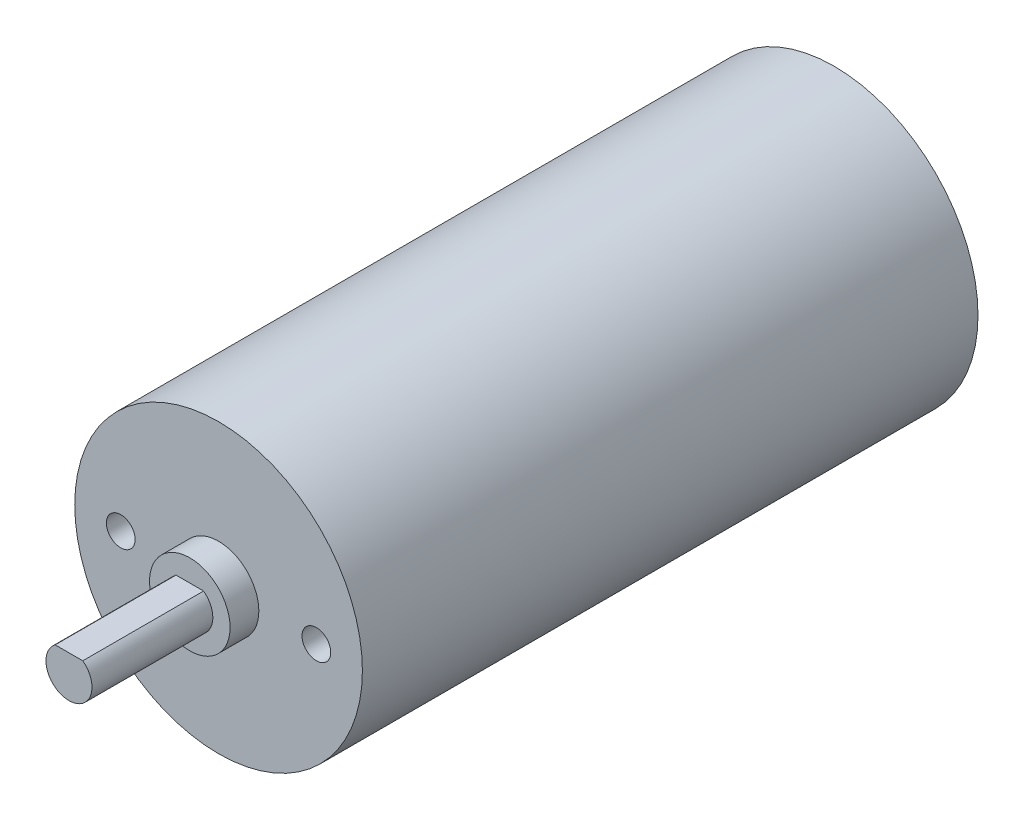
from build123d import *

# Parameters (mm, degrees)
SKETCH1_R           = 12.5
SKETCH1_R_2         = 1.25
BOSS_EXTRUDE1_DEPTH = 53.5
SKETCH2_R           = 3.5
BOSS_EXTRUDE2_DEPTH = 2.5
BOSS_EXTRUDE3_DEPTH = 10.5


with BuildPart() as part:
    # Sketch1 → Boss-Extrude1 (new body)
    with BuildSketch(Plane.XY):
        Circle(SKETCH1_R)
        with Locations((-8.5, 0)):
            Circle(SKETCH1_R_2, mode=Mode.SUBTRACT)
        with Locations((8.5, 0)):
            Circle(SKETCH1_R_2, mode=Mode.SUBTRACT)
    extrude(amount=BOSS_EXTRUDE1_DEPTH)

    # Sketch2 → Boss-Extrude2 (add)
    with BuildSketch(Plane.XY.offset(53.5)):
        Circle(SKETCH2_R)
    extrude(amount=BOSS_EXTRUDE2_DEPTH)

    # Sketch3 → Boss-Extrude3 (add)
    with BuildSketch(Plane.XY.offset(56)):
        with BuildLine():
            Line((-1.2, 1.6), (1.2, 1.6))
            ThreePointArc((1.2, 1.6), (0, -2), (-1.2, 1.6))
        make_face()
    extrude(amount=BOSS_EXTRUDE3_DEPTH)


solid = part.part
